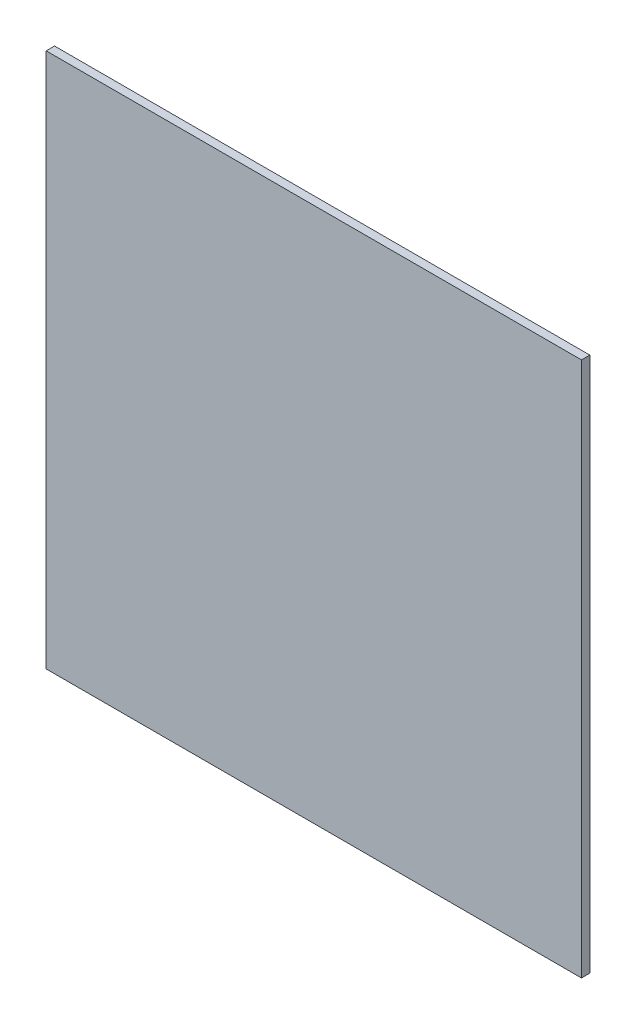
from build123d import *

# Parameters (mm, degrees)
BOSS_EXTRUDE1_DEPTH   = 19.05
BOSS_EXTRUDE1_2_DEPTH = 19.05
BOSS_EXTRUDE1_3_DEPTH = 19.05
BOSS_EXTRUDE1_4_DEPTH = 19.05
BOSS_EXTRUDE1_5_DEPTH = 19.05
BOSS_EXTRUDE1_6_DEPTH = 19.05
SKETCH2_W             = 1219.2
SKETCH2_H             = 1219.2
STOCK_DEPTH           = 19.05


with BuildPart() as part:
    # Sketch1 → Boss-Extrude1 (new body)
    with BuildSketch(Plane.XY):
        with BuildLine():
            Line((-199.808167731, 548.968429063), (-182.43354445, 501.232043927))
            ThreePointArc((-182.43354445, 501.232043927), (-533.4, 0), (-182.43354445, -501.232043927))
            Line((-182.43354445, -501.232043927), (-199.808167731, -548.968429063))
            ThreePointArc((-199.808167731, -548.968429063), (-584.2, 0), (-199.808167731, 548.968429063))
        make_face()
    extrude(amount=BOSS_EXTRUDE1_DEPTH)


with BuildPart() as body_2:
    # Sketch1 → Boss-Extrude1 2 (new body)
    with BuildSketch(Plane.XY):
        with BuildLine():
            Line((-47.408167731, 548.968429063), (-30.03354445, 501.232043927))
            ThreePointArc((-30.03354445, 501.232043927), (-381, 0), (-30.03354445, -501.232043927))
            Line((-30.03354445, -501.232043927), (-47.408167731, -548.968429063))
            ThreePointArc((-47.408167731, -548.968429063), (-431.8, 0), (-47.408167731, 548.968429063))
        make_face()
    extrude(amount=BOSS_EXTRUDE1_2_DEPTH)


with BuildPart() as body_3:
    # Sketch1 → Boss-Extrude1 3 (new body)
    with BuildSketch(Plane.XY):
        with BuildLine():
            Line((104.991832269, 548.968429063), (122.36645555, 501.232043927))
            ThreePointArc((122.36645555, 501.232043927), (-228.6, 0), (122.36645555, -501.232043927))
            Line((122.36645555, -501.232043927), (104.991832269, -548.968429063))
            ThreePointArc((104.991832269, -548.968429063), (-279.4, 0), (104.991832269, 548.968429063))
        make_face()
    extrude(amount=BOSS_EXTRUDE1_3_DEPTH)


with BuildPart() as body_4:
    # Sketch1 → Boss-Extrude1 4 (new body)
    with BuildSketch(Plane.XY):
        with BuildLine():
            Line((257.391832269, 548.968429063), (274.76645555, 501.232043927))
            ThreePointArc((274.76645555, 501.232043927), (-76.2, 0), (274.76645555, -501.232043927))
            Line((274.76645555, -501.232043927), (257.391832269, -548.968429063))
            ThreePointArc((257.391832269, -548.968429063), (-127, 0), (257.391832269, 548.968429063))
        make_face()
    extrude(amount=BOSS_EXTRUDE1_4_DEPTH)


with BuildPart() as body_5:
    # Sketch1 → Boss-Extrude1 5 (new body)
    with BuildSketch(Plane.XY):
        with BuildLine():
            Line((409.791832269, 548.968429063), (427.16645555, 501.232043927))
            ThreePointArc((427.16645555, 501.232043927), (76.2, 0), (427.16645555, -501.232043927))
            Line((427.16645555, -501.232043927), (409.791832269, -548.968429063))
            ThreePointArc((409.791832269, -548.968429063), (25.4, 0), (409.791832269, 548.968429063))
        make_face()
    extrude(amount=BOSS_EXTRUDE1_5_DEPTH)


with BuildPart() as body_6:
    # Sketch1 → Boss-Extrude1 6 (new body)
    with BuildSketch(Plane.XY):
        with BuildLine():
            Line((562.191832269, 548.968429063), (579.56645555, 501.232043927))
            ThreePointArc((579.56645555, 501.232043927), (228.6, 0), (579.56645555, -501.232043927))
            Line((579.56645555, -501.232043927), (562.191832269, -548.968429063))
            ThreePointArc((562.191832269, -548.968429063), (177.8, 0), (562.191832269, 548.968429063))
        make_face()
    extrude(amount=BOSS_EXTRUDE1_6_DEPTH)


with BuildPart() as body_7:
    # Sketch2 → Stock (new body)
    with BuildSketch(Plane.XY.offset(19.05)):
        Rectangle(SKETCH2_W, SKETCH2_H)
    extrude(amount=-STOCK_DEPTH)


solid = Compound([part.part, body_2.part, body_3.part, body_4.part, body_5.part, body_6.part, body_7.part])
